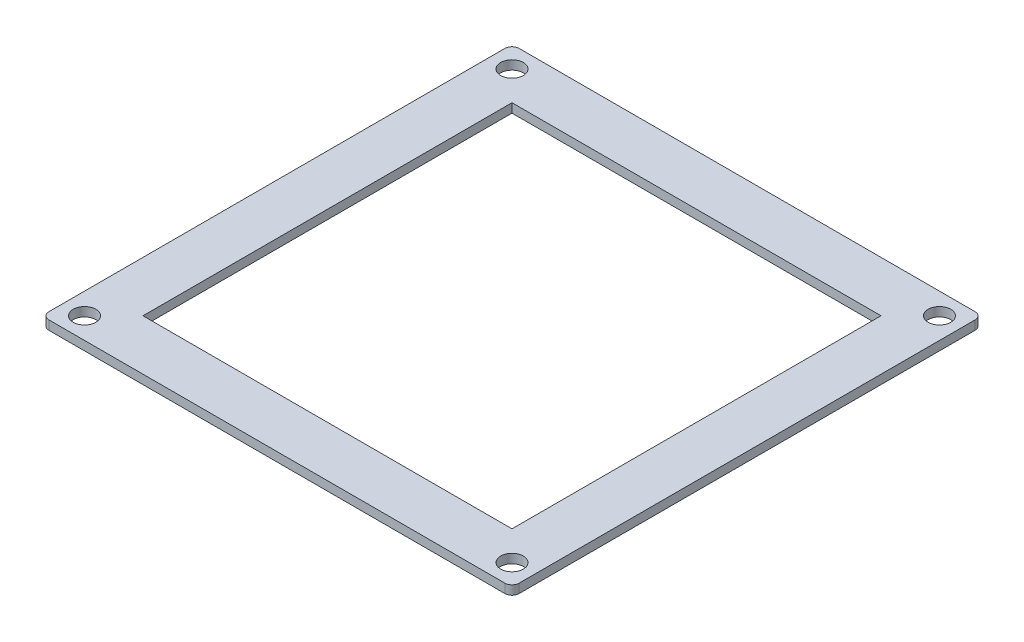
from build123d import *

# Parameters (mm, degrees)
SKETCH1_W           = 66
SKETCH1_H           = 66
SKETCH1_R           = 1.59
SKETCH1_W_2         = 51.8
SKETCH1_H_2         = 51.8
BOSS_EXTRUDE1_DEPTH = 1.27
FILLET1_R           = 1


with BuildPart() as part:
    # Sketch1 → Boss-Extrude1 (new body)
    with BuildSketch(Plane(origin=(0, 0, 0), x_dir=(1, 0, 0), z_dir=(0, 1, 0))):
        Rectangle(SKETCH1_W, SKETCH1_H)
        with Locations(Location((-30, 30, 0), (0, 0, 270))):
            Circle(SKETCH1_R, mode=Mode.SUBTRACT)
        with Locations(Location((30, 30, 0), (0, 0, 270))):
            Circle(SKETCH1_R, mode=Mode.SUBTRACT)
        with Locations(Location((30, -30, 0), (0, 0, 270))):
            Circle(SKETCH1_R, mode=Mode.SUBTRACT)
        with Locations(Location((-30, -30, 0), (0, 0, 270))):
            Circle(SKETCH1_R, mode=Mode.SUBTRACT)
        Rectangle(SKETCH1_W_2, SKETCH1_H_2, mode=Mode.SUBTRACT)
    extrude(amount=BOSS_EXTRUDE1_DEPTH)

    # Fillet1
    fillet1_edges = [part.edges().sort_by_distance(p)[0] for p in [
        (33, 0.635, 33),
        (-33, 0.635, 33),
        (-33, 0.635, -33),
        (33, 0.635, -33),
    ]]
    fillet(fillet1_edges, radius=FILLET1_R)


solid = part.part
